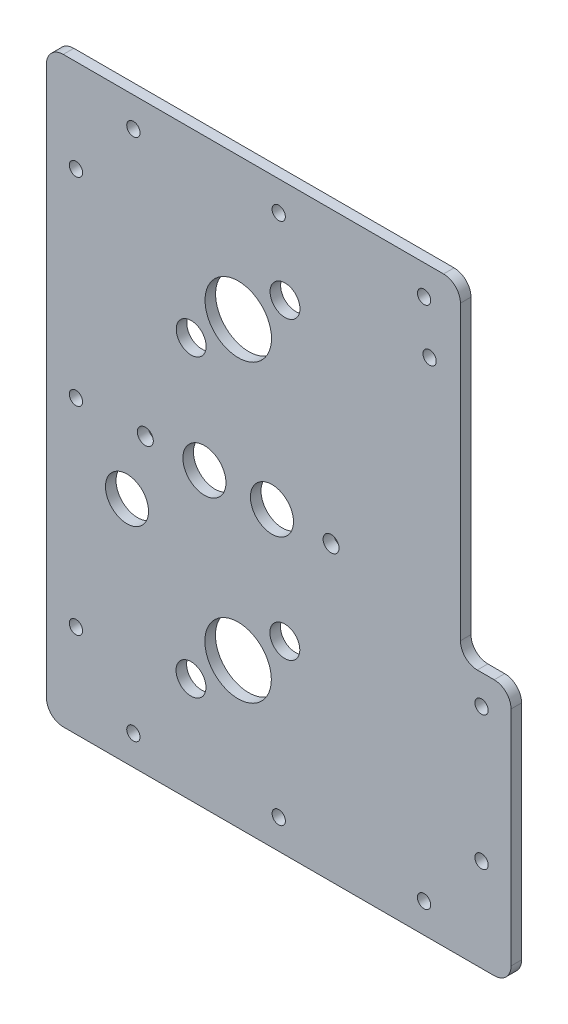
from build123d import *

# Parameters (mm, degrees)
SKETCH1_R           = 6.477
SKETCH1_R_2         = 2.4
SKETCH1_R_3         = 10
SKETCH1_R_4         = 4.5000037
SKETCH1_R_5         = 2
BOSS_EXTRUDE1_DEPTH = 3.175


with BuildPart() as part:
    # Sketch1 → Boss-Extrude1 (new body)
    with BuildSketch(Plane.XY):
        with BuildLine():
            Line((-11.024299403, 39.940302972), (-16.104299403, 39.940302972))
            ThreePointArc((-16.104299403, 39.940302972), (-19.696401851, 41.428200524), (-21.184299403, 45.020302972))
            Line((-21.184299403, 45.020302972), (-21.184299403, 132.992318995))
            ThreePointArc((-21.184299403, 132.992318995), (-22.672196955, 136.584421443), (-26.264299403, 138.072318995))
            Line((-26.264299403, 138.072318995), (-140.691302272, 138.072318995))
            ThreePointArc((-140.691302272, 138.072318995), (-144.28340472, 136.584421443), (-145.771302272, 132.992318995))
            Line((-145.771302272, 132.992318995), (-145.771302272, -32.107679937))
            ThreePointArc((-145.771302272, -32.107679937), (-144.28340472, -35.699782385), (-140.691302272, -37.187679937))
            Line((-140.691302272, -37.187679937), (-11.024299403, -37.187679937))
            ThreePointArc((-11.024299403, -37.187679937), (-7.432196955, -35.699782385), (-5.944299403, -32.107679937))
            Line((-5.944299403, -32.107679937), (-5.944299403, 34.860302972))
            ThreePointArc((-5.944299403, 34.860302972), (-7.432196955, 38.452405421), (-11.024299403, 39.940302972))
        make_face()
        with Locations((-98.216033467, 50.891145684)):
            Circle(SKETCH1_R, mode=Mode.SUBTRACT)
        with Locations((-77.896041206, 50.908879471)):
            Circle(SKETCH1_R, mode=Mode.SUBTRACT)
        with Locations((-60.103647977, 50.875628534)):
            Circle(SKETCH1_R_2, mode=Mode.SUBTRACT)
        with Locations((-115.996026696, 50.875628621)):
            Circle(SKETCH1_R_2, mode=Mode.SUBTRACT)
        with Locations((-121.514302272, 31.820805424)):
            Circle(SKETCH1_R, mode=Mode.SUBTRACT)
        with Locations((-88.029366762, 95.350052781)):
            Circle(SKETCH1_R_3, mode=Mode.SUBTRACT)
        with Locations((-102.201189802, 83.458481295)):
            Circle(SKETCH1_R_4, mode=Mode.SUBTRACT)
        with Locations((-73.96362125, 107.367473015)):
            Circle(SKETCH1_R_4, mode=Mode.SUBTRACT)
        with Locations((-88.082707911, 6.449972374)):
            Circle(SKETCH1_R_3, mode=Mode.SUBTRACT)
        with Locations((-102.254530951, -5.441599113)):
            Circle(SKETCH1_R_4, mode=Mode.SUBTRACT)
        with Locations((-74.016962399, 18.467392607)):
            Circle(SKETCH1_R_4, mode=Mode.SUBTRACT)
        with Locations((-119.595565206, 129.182318995)):
            Circle(SKETCH1_R_5, mode=Mode.SUBTRACT)
        with Locations((-75.857800837, 129.182318995)):
            Circle(SKETCH1_R_5, mode=Mode.SUBTRACT)
        with Locations((-32.120036469, 129.182318995)):
            Circle(SKETCH1_R_5, mode=Mode.SUBTRACT)
        with Locations((-136.881302272, 110.132318995)):
            Circle(SKETCH1_R_5, mode=Mode.SUBTRACT)
        with Locations((-30.45529861, 114.196317591)):
            Circle(SKETCH1_R_5, mode=Mode.SUBTRACT)
        with Locations((-136.881302272, 50.442319529)):
            Circle(SKETCH1_R_5, mode=Mode.SUBTRACT)
        with Locations((-136.881302272, -9.247679937)):
            Circle(SKETCH1_R_5, mode=Mode.SUBTRACT)
        with Locations((-119.595565206, -28.297679937)):
            Circle(SKETCH1_R_5, mode=Mode.SUBTRACT)
        with Locations((-75.857800837, -28.297679937)):
            Circle(SKETCH1_R_5, mode=Mode.SUBTRACT)
        with Locations((-32.120036469, -28.297679937)):
            Circle(SKETCH1_R_5, mode=Mode.SUBTRACT)
        with Locations((-14.834299403, -9.247679937)):
            Circle(SKETCH1_R_5, mode=Mode.SUBTRACT)
        with Locations((-14.834299403, 31.050302972)):
            Circle(SKETCH1_R_5, mode=Mode.SUBTRACT)
    extrude(amount=BOSS_EXTRUDE1_DEPTH)


solid = part.part
